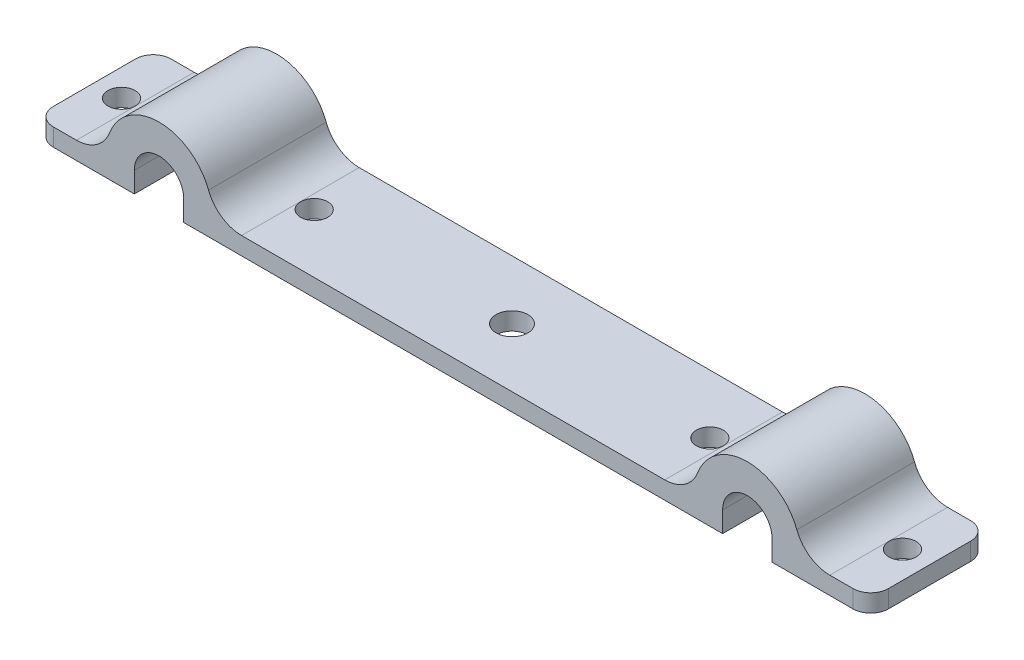
from build123d import *

# Parameters (mm, degrees)
EXTRUDE_1_DEPTH          = 20
FILLET_1_R               = 3
CUT_EXTRUDE_1_DEPTH      = 75.37216767
CUT_EXTRUDE_1_DEPTH_BACK = 75.37216767
SKETCH_2_R               = 2.7
SKETCH_2_R_2             = 2.3


with BuildPart() as part:
    # 草图1 → 凸台-拉伸1 (new body)
    with BuildSketch(Plane.XY):
        with BuildLine():
            Line((54.2, 3.8), (54.2, 0.3))
            Line((54.2, 0.3), (70.972736483, 0.3))
            Line((70.972736483, 0.3), (70.972736483, 3.3))
            Line((70.972736483, 3.3), (64.032462364, 3.3))
            ThreePointArc((64.032462364, 3.3), (60.620717942, 4.364414928), (58.419477418, 7.18))
            ThreePointArc((58.419477418, 7.18), (50, 13), (41.580522582, 7.18))
            ThreePointArc((41.580522582, 7.18), (39.379282058, 4.364414928), (35.967537636, 3.3))
            Line((35.967537636, 3.3), (-35.967537636, 3.3))
            ThreePointArc((-35.967537636, 3.3), (-39.379282058, 4.364414928), (-41.580522582, 7.18))
            ThreePointArc((-41.580522582, 7.18), (-50, 13), (-58.419477418, 7.18))
            ThreePointArc((-58.419477418, 7.18), (-60.620717942, 4.364414928), (-64.032462364, 3.3))
            Line((-64.032462364, 3.3), (-70.972736483, 3.3))
            Line((-70.972736483, 3.3), (-70.972736483, 0.3))
            Line((-70.972736483, 0.3), (-54.2, 0.3))
            Line((-54.2, 0.3), (-54.2, 3.8))
            ThreePointArc((-54.2, 3.8), (-50, 8), (-45.8, 3.8))
            Line((-45.8, 3.8), (-45.8, 0.3))
            Line((-45.8, 0.3), (45.8, 0.3))
            Line((45.8, 0.3), (45.8, 3.8))
            ThreePointArc((45.8, 3.8), (50, 8), (54.2, 3.8))
        make_face()
    extrude(amount=EXTRUDE_1_DEPTH)

    # 圆角1
    fillet_1_edges = [part.edges().sort_by_distance(p)[0] for p in [
        (70.972736483, 1.8, 20),
        (-70.972736483, 1.8, 0),
        (70.972736483, 1.8, 0),
        (-70.972736483, 1.8, 20),
    ]]
    fillet(fillet_1_edges, radius=FILLET_1_R)

    # 草图2 → 切除-拉伸1 (cut, two sides: drawn at the far end of the back side and taken through both)
    with BuildSketch(Plane(origin=(0, 3.3, 0), x_dir=(1, 0, 0), z_dir=(0, 1, 0)).offset(-CUT_EXTRUDE_1_DEPTH_BACK)):
        with Locations(Location((0, -10, 0), (0, 0, 270))):
            Circle(SKETCH_2_R)
        with Locations(Location((66.372736483, -10, 0), (0, 0, 270))):
            Circle(SKETCH_2_R_2)
        with Locations(Location((33.627263517, -10, 0), (0, 0, 270))):
            Circle(SKETCH_2_R_2)
        with Locations(Location((-33.627263517, -10, 0), (0, 0, 270))):
            Circle(SKETCH_2_R_2)
        with Locations(Location((-66.372736483, -10, 0), (0, 0, 270))):
            Circle(SKETCH_2_R_2)
    extrude(amount=CUT_EXTRUDE_1_DEPTH + CUT_EXTRUDE_1_DEPTH_BACK, mode=Mode.SUBTRACT)


solid = part.part
